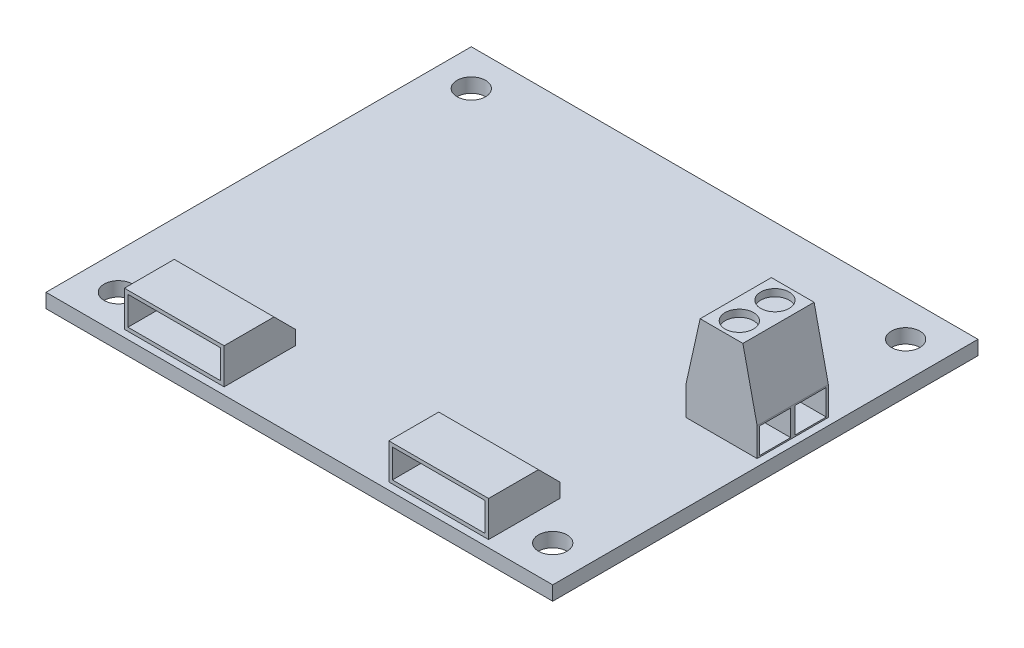
from build123d import *

# Parameters (mm, degrees)
SKETCH1_W           = 71.12
SKETCH1_H           = 59.69
BOSS_EXTRUDE1_DEPTH = 2
SKETCH2_R           = 2
CUT_EXTRUDE1_DEPTH  = 2
SKETCH3_W           = 14
SKETCH3_H           = 10
BOSS_EXTRUDE2_DEPTH = 5
SKETCH4_W           = 10
SKETCH4_H           = 10
BOSS_EXTRUDE3_DEPTH = 13
CUT_EXTRUDE2_DEPTH  = 49.882651319
SKETCH8_W           = 13
SKETCH8_H           = 4
CUT_EXTRUDE3_DEPTH  = 7
CHAMFER1_SIZE       = 3
SKETCH9_W           = 4.4
SKETCH9_H           = 3.6
CUT_EXTRUDE4_DEPTH  = 8
SKETCH10_R          = 2
CUT_EXTRUDE5_DEPTH  = 1


with BuildPart() as part:
    # Sketch1 → Boss-Extrude1 (new body)
    with BuildSketch(Plane(origin=(0, 0, 0), x_dir=(1, 0, 0), z_dir=(0, 1, 0))):
        Rectangle(SKETCH1_W, SKETCH1_H)
    extrude(amount=BOSS_EXTRUDE1_DEPTH)

    # Sketch2 → Cut-Extrude1 (cut)
    with BuildSketch(Plane(origin=(0, 2, 0), x_dir=(1, 0, 0), z_dir=(0, 1, 0))):
        with Locations(Location((-30.48, 24.765, 0), (0, 0, 270))):
            Circle(SKETCH2_R)
        with Locations(Location((30.48, 24.765, 0), (0, 0, 270))):
            Circle(SKETCH2_R)
        with Locations(Location((30.48, -24.765, 0), (0, 0, 270))):
            Circle(SKETCH2_R)
        with Locations(Location((-30.48, -24.765, 0), (0, 0, 270))):
            Circle(SKETCH2_R)
    extrude(amount=-CUT_EXTRUDE1_DEPTH, mode=Mode.SUBTRACT)

    # Sketch3 → Boss-Extrude2 (add)
    with BuildSketch(Plane(origin=(0, 2, 0), x_dir=(1, 0, 0), z_dir=(0, 1, 0))):
        with Locations((-18.56, -23.845)):
            Rectangle(SKETCH3_W, SKETCH3_H)
        with Locations((18.56, -23.845)):
            Rectangle(SKETCH3_W, SKETCH3_H)
    extrude(amount=BOSS_EXTRUDE2_DEPTH)

    # Sketch4 → Boss-Extrude3 (add)
    with BuildSketch(Plane(origin=(0, 2, 0), x_dir=(1, 0, 0), z_dir=(0, 1, 0))):
        with Locations((29.56, 4.845)):
            Rectangle(SKETCH4_W, SKETCH4_H)
    extrude(amount=BOSS_EXTRUDE3_DEPTH)

    # Sketch7 → Cut-Extrude2 (cut, through all)
    with BuildSketch(Plane.XY.offset(0.155)):
        Polygon((26.56, 15), (24.56, 6), (24.56, 15), align=None)
        Polygon((34.56, 6), (32.56, 15), (34.56, 15), align=None)
    extrude(amount=-CUT_EXTRUDE2_DEPTH, mode=Mode.SUBTRACT)

    # Sketch8 → Cut-Extrude3 (cut)
    with BuildSketch(Plane.XY.offset(28.845)):
        with Locations((-18.56, 4.5)):
            Rectangle(SKETCH8_W, SKETCH8_H)
        with Locations((18.56, 4.5)):
            Rectangle(SKETCH8_W, SKETCH8_H)
    extrude(amount=-CUT_EXTRUDE3_DEPTH, mode=Mode.SUBTRACT)

    # Chamfer1
    chamfer1_edges = [part.edges().sort_by_distance(p)[0] for p in [
        (-18.56, 7, 18.845),
        (18.56, 7, 18.845),
    ]]
    chamfer(chamfer1_edges, length=CHAMFER1_SIZE)

    # Sketch9 → Cut-Extrude4 (cut)
    with BuildSketch(Plane(origin=(34.56, 0, 0), x_dir=(0, 0, -1), z_dir=(1, 0, 0))):
        with Locations((7.345, 4)):
            Rectangle(SKETCH9_W, SKETCH9_H)
        with Locations((2.345, 4)):
            Rectangle(SKETCH9_W, SKETCH9_H)
    extrude(amount=-CUT_EXTRUDE4_DEPTH, mode=Mode.SUBTRACT)

    # Sketch10 → Cut-Extrude5 (cut)
    with BuildSketch(Plane(origin=(0, 15, 0), x_dir=(1, 0, 0), z_dir=(0, 1, 0))):
        with Locations(Location((29.56, 7.345, 0), (0, 0, 270))):
            Circle(SKETCH10_R)
        with Locations(Location((29.56, 2.345, 0), (0, 0, 90))):
            Circle(SKETCH10_R)
    extrude(amount=-CUT_EXTRUDE5_DEPTH, mode=Mode.SUBTRACT)


solid = part.part
